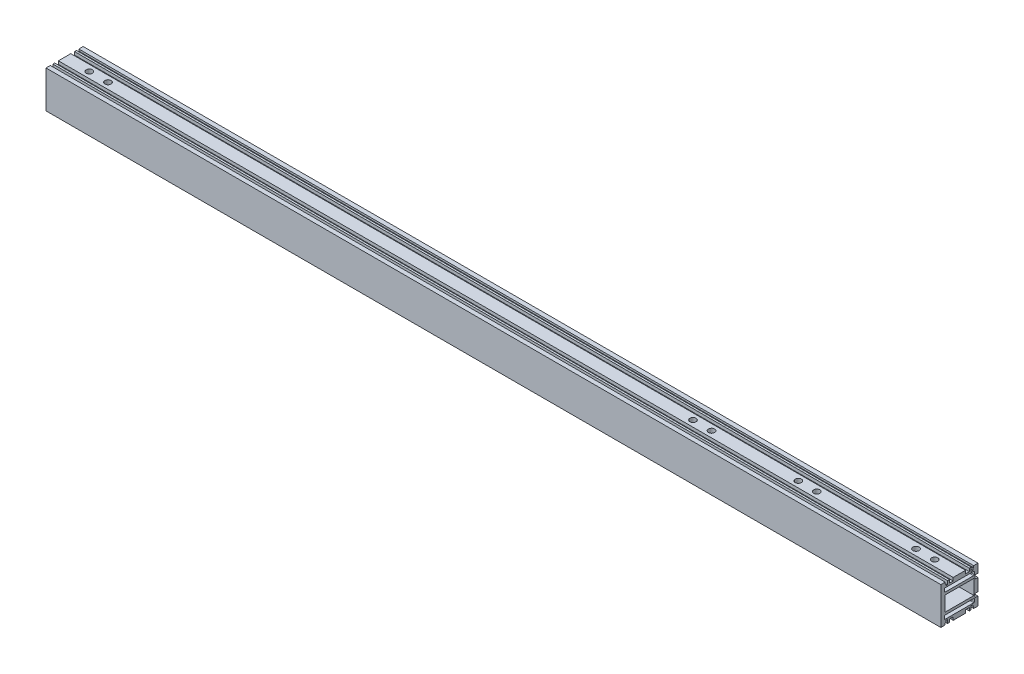
from build123d import *

# Parameters (mm, degrees)
SKETCH_1_W             = 23.5
SKETCH_1_H             = 12
EXTRUDE_1_DEPTH        = 361
HOLE_WIZARD_M6_1_D     = 5
HOLE_WIZARD_M6_1_DEPTH = 19
HOLE_WIZARD_M6_1_TIP   = 1.502151548
HOLE_WIZARD_M6_2_D     = 5
HOLE_WIZARD_M6_2_DEPTH = 19
HOLE_WIZARD_M6_2_TIP   = 1.502151548
HOLE_WIZARD_M4_1_D     = 3.3
HOLE_WIZARD_M4_1_DEPTH = 11.5
HOLE_WIZARD_M4_1_TIP   = 0.991420021
HOLE_WIZARD_M6_4_D     = 5
HOLE_WIZARD_M6_4_DEPTH = 19
HOLE_WIZARD_M6_4_TIP   = 1.502151548


with BuildPart() as part:
    # 草图1 → 凸台-拉伸1 (new, symmetric)
    with BuildSketch(Plane(origin=(0, 0, 0), x_dir=(0, 0, -1), z_dir=(1, 0, 0))):
        Polygon((-15, 15), (-11.5, 15), (-11.5, 13.5), (-11, 13.5), (-11, 12), (-9.5, 12), (-9.5, 15), (-8, 15), (-8, 12.5), (-5, 12.5), (-5, 15), (5, 15), (5, 12.5), (8, 12.5), (8, 15), (9.5, 15), (9.5, 12), (11, 12), (11, 13.5), (11.5, 13.5), (11.5, 15), (15, 15), (15, 8), (12.5, 8), (12.5, 5), (15, 5), (15, -5), (12.5, -5), (12.5, -8), (15, -8), (15, -15), (11.5, -15), (11.5, -13.5), (11, -13.5), (11, -12), (9.5, -12), (9.5, -15), (8, -15), (8, -12.5), (5, -12.5), (5, -15), (-5, -15), (-5, -12.5), (-8, -12.5), (-8, -15), (-9.5, -15), (-9.5, -12), (-11, -12), (-11, -13.5), (-11.5, -13.5), (-11.5, -15), (-15, -15), align=None)
        with BuildLine():
            Line((12, -10.5), (12, -8.5))
            ThreePointArc((12, -8.5), (11.853553391, -8.146446609), (11.5, -8))
            Line((11.5, -8), (-11.5, -8))
            ThreePointArc((-11.5, -8), (-11.853553391, -8.146446609), (-12, -8.5))
            Line((-12, -8.5), (-12, -10.5))
            ThreePointArc((-12, -10.5), (-11.853553391, -10.853553391), (-11.5, -11))
            Line((-11.5, -11), (11.5, -11))
            ThreePointArc((11.5, -11), (11.853553391, -10.853553391), (12, -10.5))
        make_face(mode=Mode.SUBTRACT)
        with BuildLine():
            Line((-11.5, 11), (11.5, 11))
            ThreePointArc((11.5, 11), (11.853553391, 10.853553391), (12, 10.5))
            Line((12, 10.5), (12, 8.5))
            ThreePointArc((12, 8.5), (11.853553391, 8.146446609), (11.5, 8))
            Line((11.5, 8), (-11.5, 8))
            ThreePointArc((-11.5, 8), (-11.853553391, 8.146446609), (-12, 8.5))
            Line((-12, 8.5), (-12, 10.5))
            ThreePointArc((-12, 10.5), (-11.853553391, 10.853553391), (-11.5, 11))
        make_face(mode=Mode.SUBTRACT)
        Rectangle(SKETCH_1_W, SKETCH_1_H, mode=Mode.SUBTRACT)
    extrude(amount=EXTRUDE_1_DEPTH, both=True)

    # M6 螺纹孔1
    with Locations(Plane(origin=(0, 15, 0), x_dir=(1, 0, 0), z_dir=(0, 1, 0))):
        with Locations((341, 0), (326, 0), (246, 0), (231, 0), (161, 0), (146, 0), (-326, 0), (-341, 0)):
            Hole(HOLE_WIZARD_M6_1_D / 2, depth=HOLE_WIZARD_M6_1_DEPTH)
            with Locations((0, 0, -(HOLE_WIZARD_M6_1_DEPTH + HOLE_WIZARD_M6_1_TIP / 2))):  # 118° drill point
                Cone(0, HOLE_WIZARD_M6_1_D / 2, HOLE_WIZARD_M6_1_TIP, mode=Mode.SUBTRACT)

    # M6 螺纹孔2
    with Locations(Plane(origin=(0, -15, 0), x_dir=(-1, 0, 0), z_dir=(0, -1, 0))):
        with Locations((-128, 0), (-113, 0), (326, 0), (341, 0), (241, 0), (163, 0)):
            Hole(HOLE_WIZARD_M6_2_D / 2, depth=HOLE_WIZARD_M6_2_DEPTH)
            with Locations((0, 0, -(HOLE_WIZARD_M6_2_DEPTH + HOLE_WIZARD_M6_2_TIP / 2))):  # 118° drill point
                Cone(0, HOLE_WIZARD_M6_2_D / 2, HOLE_WIZARD_M6_2_TIP, mode=Mode.SUBTRACT)

    # M4 螺纹孔1
    with Locations(Plane(origin=(0, 0, -15), x_dir=(-1, 0, 0), z_dir=(0, 0, -1))):
        with Locations((353, 0), (326, 0)):
            Hole(HOLE_WIZARD_M4_1_D / 2, depth=HOLE_WIZARD_M4_1_DEPTH)
            with Locations((0, 0, -(HOLE_WIZARD_M4_1_DEPTH + HOLE_WIZARD_M4_1_TIP / 2))):  # 118° drill point
                Cone(0, HOLE_WIZARD_M4_1_D / 2, HOLE_WIZARD_M4_1_TIP, mode=Mode.SUBTRACT)

    # M6 螺纹孔4
    with Locations(Plane(origin=(0, 0, -15), x_dir=(-1, 0, 0), z_dir=(0, 0, -1))):
        with Locations((-326, 0), (-341, 0)):
            Hole(HOLE_WIZARD_M6_4_D / 2, depth=HOLE_WIZARD_M6_4_DEPTH)
            with Locations((0, 0, -(HOLE_WIZARD_M6_4_DEPTH + HOLE_WIZARD_M6_4_TIP / 2))):  # 118° drill point
                Cone(0, HOLE_WIZARD_M6_4_D / 2, HOLE_WIZARD_M6_4_TIP, mode=Mode.SUBTRACT)


solid = part.part
